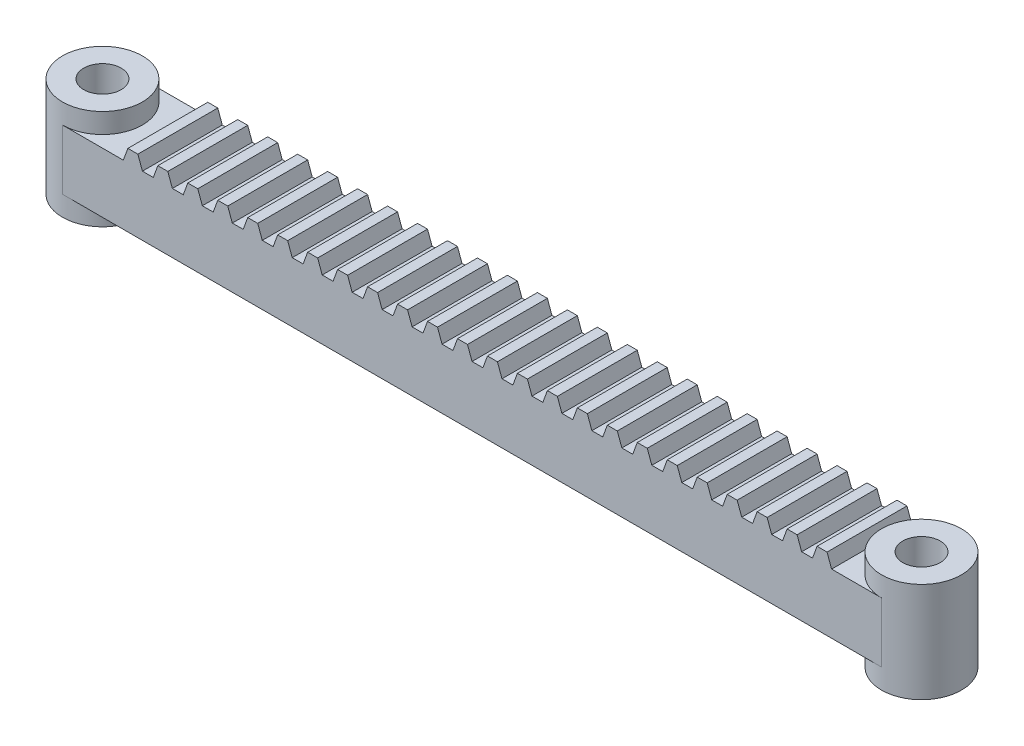
from build123d import *

# Parameters (mm, degrees)
BOSS_EXTRUDE1_DEPTH = 6
SKETCH1_4_R         = 8
SKETCH1_4_R_2       = 3.75
BOSS_EXTRUDE2_DEPTH = 10
BOSS_EXTRUDE4_DEPTH = 16
LPATTERN1_COUNT     = 24
LPATTERN1_PITCH     = 6


with BuildPart() as part:
    # Sketch1 → Boss-Extrude1 (new, symmetric)
    with BuildSketch(Plane(origin=(0, 0, 0), x_dir=(1, 0, 0), z_dir=(0, 1, 0))):
        with BuildLine():
            Line((82, 8), (-82, 8))
            ThreePointArc((-82, 8), (-76.343145751, 5.656854249), (-74, 0))
            ThreePointArc((-74, 0), (-76.343145751, -5.656854249), (-82, -8))
            Line((-82, -8), (82, -8))
            ThreePointArc((82, -8), (74, 0), (82, 8))
        make_face()
    extrude(amount=BOSS_EXTRUDE1_DEPTH, both=True)

    # Sketch1<4> → Boss-Extrude2 (add, symmetric)
    # profile 1 of 2: a face of its own
    with BuildSketch(Plane(origin=(0, 0, 0), x_dir=(1, 0, 0), z_dir=(0, 1, 0))):
        with Locations((-82, 0)):
            Circle(SKETCH1_4_R)
        with Locations((-82, 0)):
            Circle(SKETCH1_4_R_2, mode=Mode.SUBTRACT)
    # profile 2 of 2: a face of its own
    with BuildSketch(Plane(origin=(0, 0, 0), x_dir=(1, 0, 0), z_dir=(0, 1, 0))):
        with Locations((82, 0)):
            Circle(SKETCH1_4_R)
        with Locations((82, 0)):
            Circle(SKETCH1_4_R_2, mode=Mode.SUBTRACT)
    extrude(amount=BOSS_EXTRUDE2_DEPTH, both=True)

    # Sketch4 → Boss-Extrude4 (add)
    with BuildSketch(Plane.XY.offset(8)):
        Polygon((72, 6), (71.090074414, 8.5), (69.090074414, 8.5), (68.180148829, 6), align=None)
    boss_extrude4 = extrude(amount=-BOSS_EXTRUDE4_DEPTH)

    # LPattern1: Boss-Extrude4 ×24
    with Locations(*[(-i * LPATTERN1_PITCH, 0, 0) for i in range(1, LPATTERN1_COUNT)]):
        add(boss_extrude4)


solid = part.part
